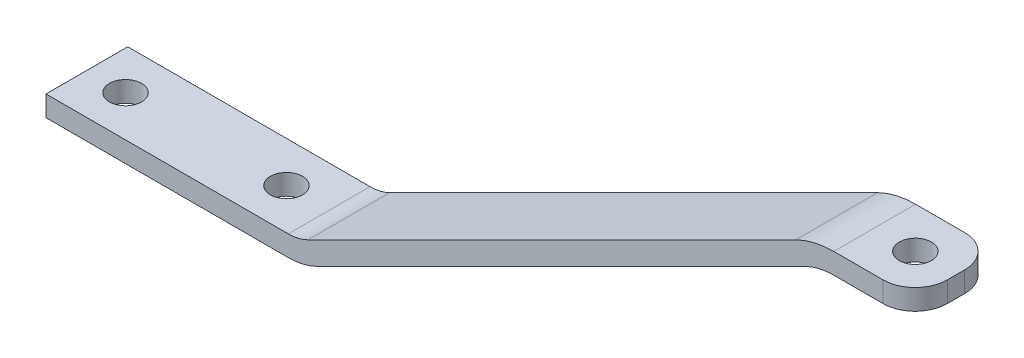
from build123d import *

# Parameters (mm, degrees)
RESSALTO_EXTRUS_O1_DEPTH = 12.7
ESBO_O2_R                = 2.5
CORTE_EXTRUS_O1_DEPTH    = 142.372875758
ESBO_O3_R                = 2.5
CORTE_EXTRUS_O2_DEPTH    = 143.311383944
FILETE1_R                = 5
FILETE2_R                = 5


with BuildPart() as part:
    # Esboço1 → Ressalto-extrusão1 (new body)
    with BuildSketch(Plane.XY):
        with BuildLine():
            Line((0, 0), (37.639320225, 0))
            ThreePointArc((37.639320225, 0), (39.93684943, 0.267510105), (42.11145618, 1.05572809))
            Line((42.11145618, 1.05572809), (117.88854382, 38.94427191))
            ThreePointArc((117.88854382, 38.94427191), (120.06315057, 39.732489895), (122.360679775, 40))
            Line((122.360679775, 40), (135, 40))
            Line((135, 40), (135, 43.2))
            Line((135, 43.2), (122.360679775, 43.2))
            ThreePointArc((122.360679775, 43.2), (119.327941224, 42.846886661), (116.457460314, 41.806438921))
            Line((116.457460314, 41.806438921), (40.680372674, 3.917895101))
            ThreePointArc((40.680372674, 3.917895101), (39.201640085, 3.381906872), (37.639320225, 3.2))
            Line((37.639320225, 3.2), (0, 3.2))
            Line((0, 3.2), (0, 0))
        make_face()
    extrude(amount=RESSALTO_EXTRUS_O1_DEPTH)

    # Esboço2 → Corte-extrusão1 (cut, through all)
    with BuildSketch(Plane(origin=(0, 3.2, 0), x_dir=(1, 0, 0), z_dir=(0, 1, 0))):
        with Locations(Location((6, -6.35, 0), (0, 0, 270))):
            Circle(ESBO_O2_R)
        with Locations(Location((31, -6.35, 0), (0, 0, 270))):
            Circle(ESBO_O2_R)
    extrude(amount=-CORTE_EXTRUS_O1_DEPTH, mode=Mode.SUBTRACT)

    # Esboço3 → Corte-extrusão2 (cut, through all)
    with BuildSketch(Plane(origin=(0, 43.2, 0), x_dir=(1, 0, 0), z_dir=(0, 1, 0))):
        with Locations(Location((128.680339887, -6.35, 0), (0, 0, 270))):
            Circle(ESBO_O3_R)
    extrude(amount=-CORTE_EXTRUS_O2_DEPTH, mode=Mode.SUBTRACT)

    # Filete1
    filete1_edges = [part.edges().sort_by_distance(p)[0] for p in [
        (135, 41.6, 12.7),
    ]]
    fillet(filete1_edges, radius=FILETE1_R)

    # Filete2
    filete2_edges = [part.edges().sort_by_distance(p)[0] for p in [
        (135, 41.6, 0),
    ]]
    fillet(filete2_edges, radius=FILETE2_R)


solid = part.part
